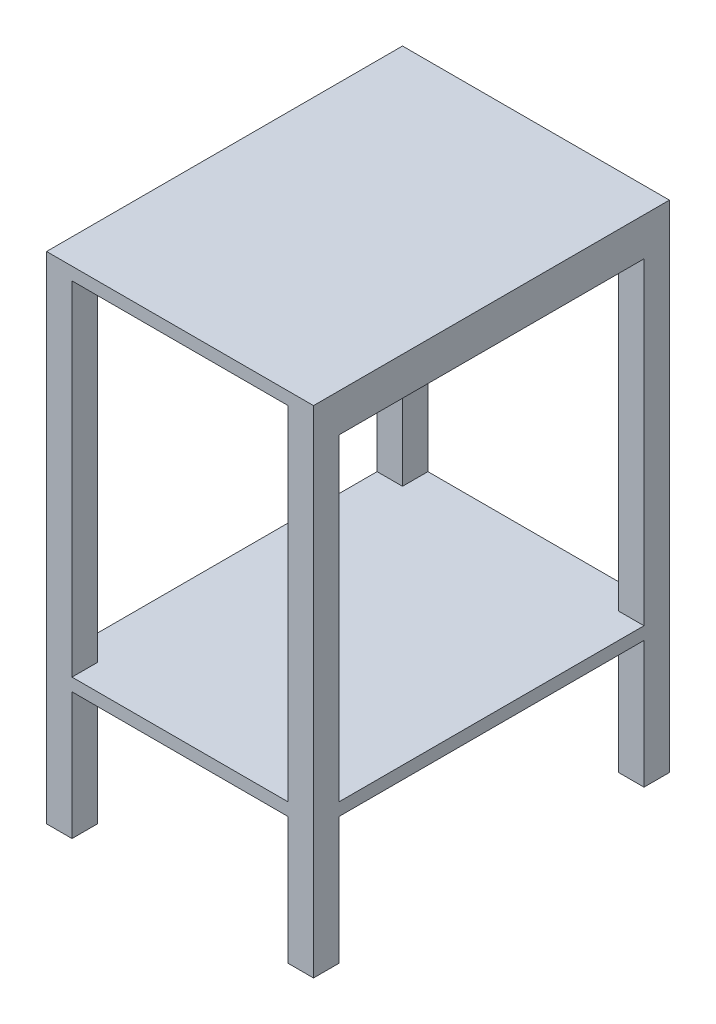
from build123d import *

# Parameters (mm, degrees)
SKETCH1_W           = 210
SKETCH1_H           = 280
BOSS_EXTRUDE1_DEPTH = 390
SKETCH4_W           = 240
SKETCH4_H           = 100
SKETCH4_H_2         = 250
CUT_EXTRUDE1_DEPTH  = 300
SKETCH5_W           = 170
SKETCH5_H           = 100
SKETCH5_H_2         = 270
CUT_EXTRUDE2_DEPTH  = 300


with BuildPart() as part:
    # Sketch1 → Boss-Extrude1 (new body)
    with BuildSketch(Plane(origin=(0, 0, 0), x_dir=(1, 0, 0), z_dir=(0, 1, 0))):
        Rectangle(SKETCH1_W, SKETCH1_H)
    extrude(amount=BOSS_EXTRUDE1_DEPTH)

    # Sketch4 → Cut-Extrude1 (cut)
    with BuildSketch(Plane(origin=(105, 0, 0), x_dir=(0, 0, -1), z_dir=(1, 0, 0))):
        with Locations((0, 50)):
            Rectangle(SKETCH4_W, SKETCH4_H)
        with Locations((0, 235)):
            Rectangle(SKETCH4_W, SKETCH4_H_2)
    extrude(amount=-CUT_EXTRUDE1_DEPTH, mode=Mode.SUBTRACT)

    # Sketch5 → Cut-Extrude2 (cut)
    with BuildSketch(Plane.XY.offset(140)):
        with Locations((0, 50)):
            Rectangle(SKETCH5_W, SKETCH5_H)
        with Locations((0, 245)):
            Rectangle(SKETCH5_W, SKETCH5_H_2)
    extrude(amount=-CUT_EXTRUDE2_DEPTH, mode=Mode.SUBTRACT)


solid = part.part
